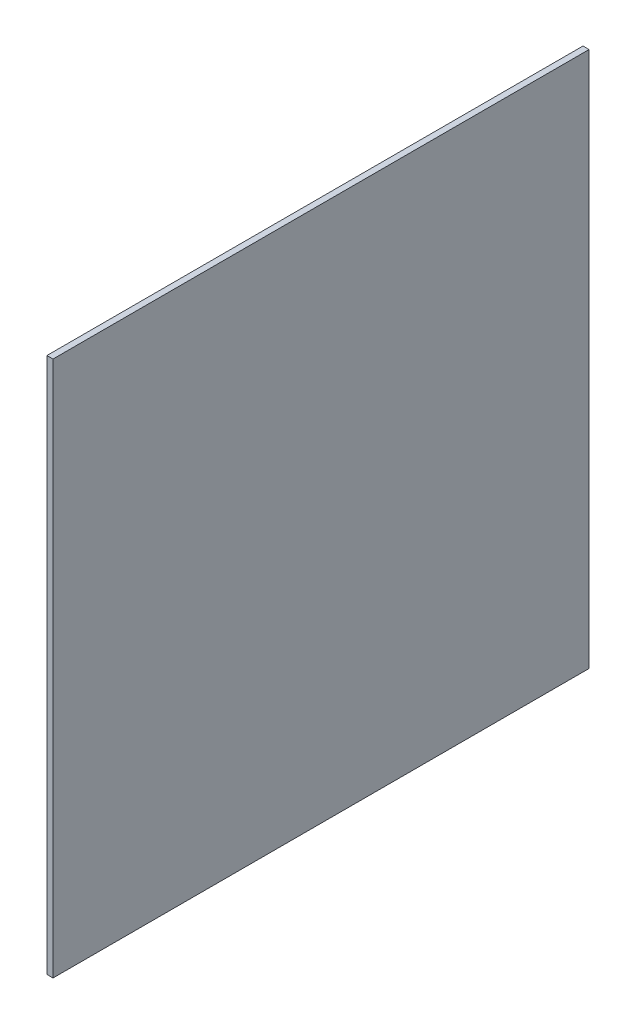
from build123d import *

# Parameters (mm, degrees)
SKETCH1_W           = 139.7
SKETCH1_H           = 139.7
BOSS_EXTRUDE1_DEPTH = 1.5875


with BuildPart() as part:
    # Sketch1 → Boss-Extrude1 (new body)
    with BuildSketch(Plane(origin=(0, 0, 0), x_dir=(0, 0, -1), z_dir=(1, 0, 0))):
        with Locations((69.85, 69.85)):
            Rectangle(SKETCH1_W, SKETCH1_H)
    extrude(amount=BOSS_EXTRUDE1_DEPTH)


solid = part.part
